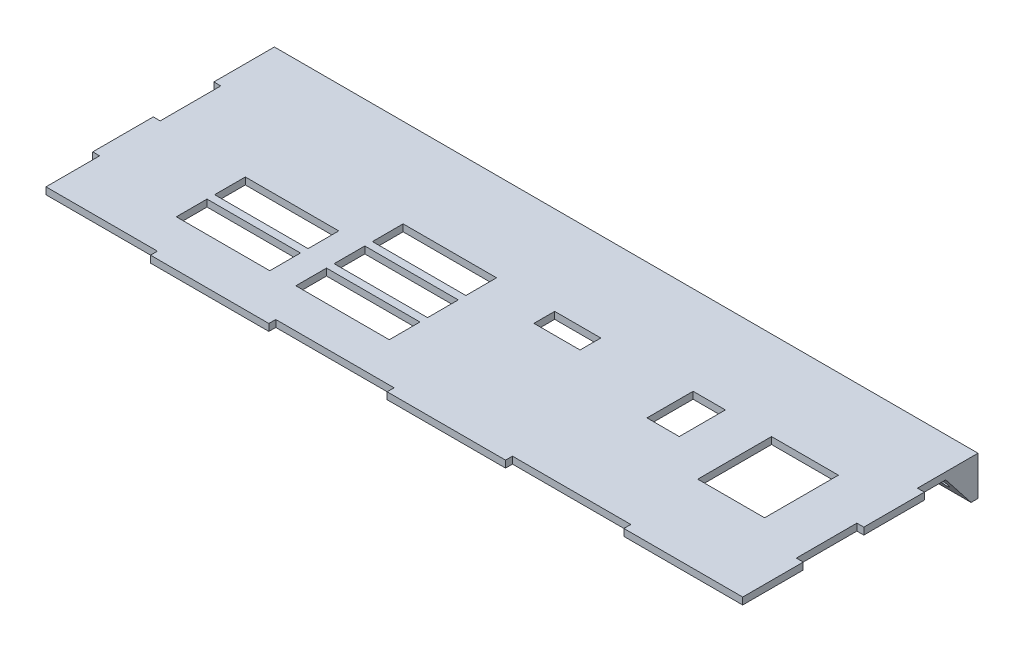
from build123d import *

# Parameters (mm, degrees)
EXTRUDE_1_DEPTH     = 3
SKETCH_2_W          = 40.5
SKETCH_2_H          = 13.3
SKETCH_2_W_2        = 20
SKETCH_2_H_2        = 9
SKETCH_2_W_3        = 14
SKETCH_2_H_3        = 20
SKETCH_2_W_4        = 29
SKETCH_2_H_4        = 32
CUT_EXTRUDE_1_DEPTH = 3
SKETCH_3_W          = 51.3
SKETCH_3_H          = 3
CUT_EXTRUDE_2_DEPTH = 3
SKETCH_4_W          = 4
SKETCH_4_H          = 28
SKETCH_4_W_2        = 14
SKETCH_4_H_2        = 14
EXTRUDE_2_DEPTH     = 14
CUT_EXTRUDE_3_DEPTH = 14
CUT_EXTRUDE_4_DEPTH = 14
CUT_EXTRUDE_5_DEPTH = 14
CUT_EXTRUDE_6_REACH = 216.55
SKETCH_9_R          = 2.5


with BuildPart() as part:
    # Эскиз1 → Бобышка-Вытянуть1 (new body)
    with BuildSketch(Plane(origin=(0, 0, 0), x_dir=(1, 0, 0), z_dir=(0, 1, 0))):
        Polygon((-121.424018304, 15.144551695), (-121.424018304, 41.394551695), (183.575981696, 41.394551695), (183.575981696, 15.144551695), (186.575981696, 15.144551695), (186.575981696, -11.105448305), (183.575981696, -11.105448305), (183.575981696, -37.355448305), (186.575981696, -37.355448305), (186.575981696, -63.605448305), (-118.424018304, -63.605448305), (-118.424018304, -37.355448305), (-121.424018304, -37.355448305), (-121.424018304, -11.105448305), (-118.424018304, -11.105448305), (-118.424018304, 15.144551695), align=None)
    extrude(amount=EXTRUDE_1_DEPTH)

    # Эскиз2 → Вырез-Вытянуть1 (cut)
    with BuildSketch(Plane(origin=(0, 3, 0), x_dir=(1, 0, 0), z_dir=(0, 1, 0))):
        with Locations((-58.674018304, -36.955448305)):
            Rectangle(SKETCH_2_W, SKETCH_2_H)
        with Locations((-6.874018304, -36.955448305)):
            Rectangle(SKETCH_2_W, SKETCH_2_H)
        with Locations((-6.874018304, -20.355448305)):
            Rectangle(SKETCH_2_W, SKETCH_2_H)
        with Locations((-58.674018304, -20.355448305)):
            Rectangle(SKETCH_2_W, SKETCH_2_H)
        with Locations((-6.874018304, -3.755448305)):
            Rectangle(SKETCH_2_W, SKETCH_2_H)
        with Locations((48.575981696, -1.605448305)):
            Rectangle(SKETCH_2_W_2, SKETCH_2_H_2)
        with Locations((105.575981696, -7.105448305)):
            Rectangle(SKETCH_2_W_3, SKETCH_2_H_3)
        with Locations((147.075981696, -13.105448305)):
            Rectangle(SKETCH_2_W_4, SKETCH_2_H_4)
    extrude(amount=-CUT_EXTRUDE_1_DEPTH, mode=Mode.SUBTRACT)

    # Эскиз3 → Вырез-Вытянуть2 (cut)
    with BuildSketch(Plane(origin=(0, 3, 0), x_dir=(1, 0, 0), z_dir=(0, 1, 0))):
        with Locations((-95.774018304, -62.105448305)):
            Rectangle(SKETCH_3_W, SKETCH_3_H)
        with Locations((6.825981696, -62.105448305)):
            Rectangle(SKETCH_3_W, SKETCH_3_H)
        with Locations((109.425981696, -62.105448305)):
            Rectangle(SKETCH_3_W, SKETCH_3_H)
    extrude(amount=-CUT_EXTRUDE_2_DEPTH, mode=Mode.SUBTRACT)

    # Эскиз4 → Бобышка-Вытянуть2 (add)
    with BuildSketch(Plane.XZ):
        with Locations((27.575981696, -27.394551695)):
            Rectangle(SKETCH_4_W, SKETCH_4_H)
        with Locations((-111.424018304, -34.394551695)):
            Rectangle(SKETCH_4_W_2, SKETCH_4_H_2)
        with Locations((176.575981696, -34.394551695)):
            Rectangle(SKETCH_4_W_2, SKETCH_4_H_2)
        with Locations((37.575981696, -27.394551695)):
            Rectangle(SKETCH_4_W, SKETCH_4_H)
    extrude(amount=EXTRUDE_2_DEPTH)

    # Эскиз6 → Вырез-Вытянуть3 (cut)
    with BuildSketch(Plane(origin=(39.575981696, 0, 0), x_dir=(0, 0, -1), z_dir=(1, 0, 0))):
        Polygon((13.394551695, -14), (13.394551695, 0), (38.394551695, -14), align=None)
    extrude(amount=-CUT_EXTRUDE_3_DEPTH, mode=Mode.SUBTRACT)

    # Эскиз7 → Вырез-Вытянуть4 (cut)
    with BuildSketch(Plane(origin=(183.575981696, 0, 0), x_dir=(0, 0, -1), z_dir=(1, 0, 0))):
        Polygon((27.394551695, -14), (27.394551695, 0), (38.394551695, -14), align=None)
    extrude(amount=-CUT_EXTRUDE_4_DEPTH, mode=Mode.SUBTRACT)

    # Эскиз8 → Вырез-Вытянуть5 (cut)
    with BuildSketch(Plane(origin=(-104.424018304, 0, 0), x_dir=(0, 0, -1), z_dir=(1, 0, 0))):
        Polygon((27.394551695, -14), (27.394551695, 0), (38.394551695, -14), align=None)
    extrude(amount=-CUT_EXTRUDE_5_DEPTH, mode=Mode.SUBTRACT)

    # Вырез-Вытянуть6: up to this plane
    cut_extrude_6_end = Plane(origin=(169.575981696, -14, -38.394551695), z_dir=(0, 0.6178215519319037, -0.7863183388224225))
    # Эскиз9 → Вырез-Вытянуть6 (cut, up to the surface)
    with BuildSketch(Plane(origin=(0, 0, -41.394551695), x_dir=(-1, 0, 0), z_dir=(0, 0, -1)), mode=Mode.PRIVATE) as cut_extrude_6_sk1:
        with Locations((-176.575981696, -7)):
            Circle(SKETCH_9_R)
    cut_extrude_6_tool1 = split(extrude(cut_extrude_6_sk1.sketch, amount=-CUT_EXTRUDE_6_REACH, mode=Mode.PRIVATE), bisect_by=cut_extrude_6_end, keep=Keep.BOTH, mode=Mode.PRIVATE)
    add(cut_extrude_6_tool1.solids().sort_by_distance((176.575982, -7, -41.394552))[0], mode=Mode.SUBTRACT)
    # Эскиз9 → Вырез-Вытянуть6 (cut, up to the surface)
    with BuildSketch(Plane(origin=(0, 0, -41.394551695), x_dir=(-1, 0, 0), z_dir=(0, 0, -1)), mode=Mode.PRIVATE) as cut_extrude_6_sk2:
        with Locations((111.424018304, -7)):
            Circle(SKETCH_9_R)
    cut_extrude_6_tool2 = split(extrude(cut_extrude_6_sk2.sketch, amount=-CUT_EXTRUDE_6_REACH, mode=Mode.PRIVATE), bisect_by=cut_extrude_6_end, keep=Keep.BOTH, mode=Mode.PRIVATE)
    add(cut_extrude_6_tool2.solids().sort_by_distance((-111.424018, -7, -41.394552))[0], mode=Mode.SUBTRACT)


solid = part.part
